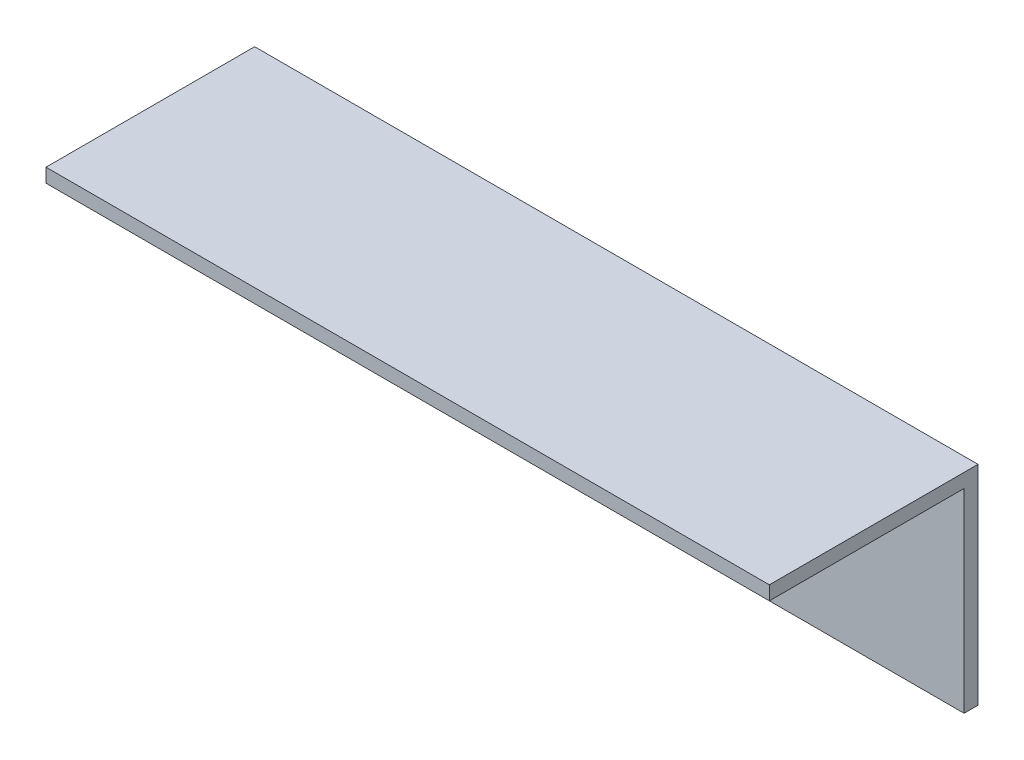
from build123d import *

# Parameters (mm, degrees)
SKETCH_1_W          = 104
SKETCH_1_H          = 30
EXTRUDE_1_DEPTH     = 30
SKETCH_2_W          = 104
SKETCH_2_H          = 28
CUT_EXTRUDE_1_DEPTH = 28


with BuildPart() as part:
    # 草圖1 → 填料-伸長1 (new body)
    with BuildSketch(Plane.XY):
        with Locations((-52, 15)):
            Rectangle(SKETCH_1_W, SKETCH_1_H)
    extrude(amount=EXTRUDE_1_DEPTH)

    # 草圖2 → 除料-伸長1 (cut)
    with BuildSketch(Plane.XY.offset(30)):
        with Locations((-52, 14)):
            Rectangle(SKETCH_2_W, SKETCH_2_H)
    extrude(amount=-CUT_EXTRUDE_1_DEPTH, mode=Mode.SUBTRACT)


solid = part.part
